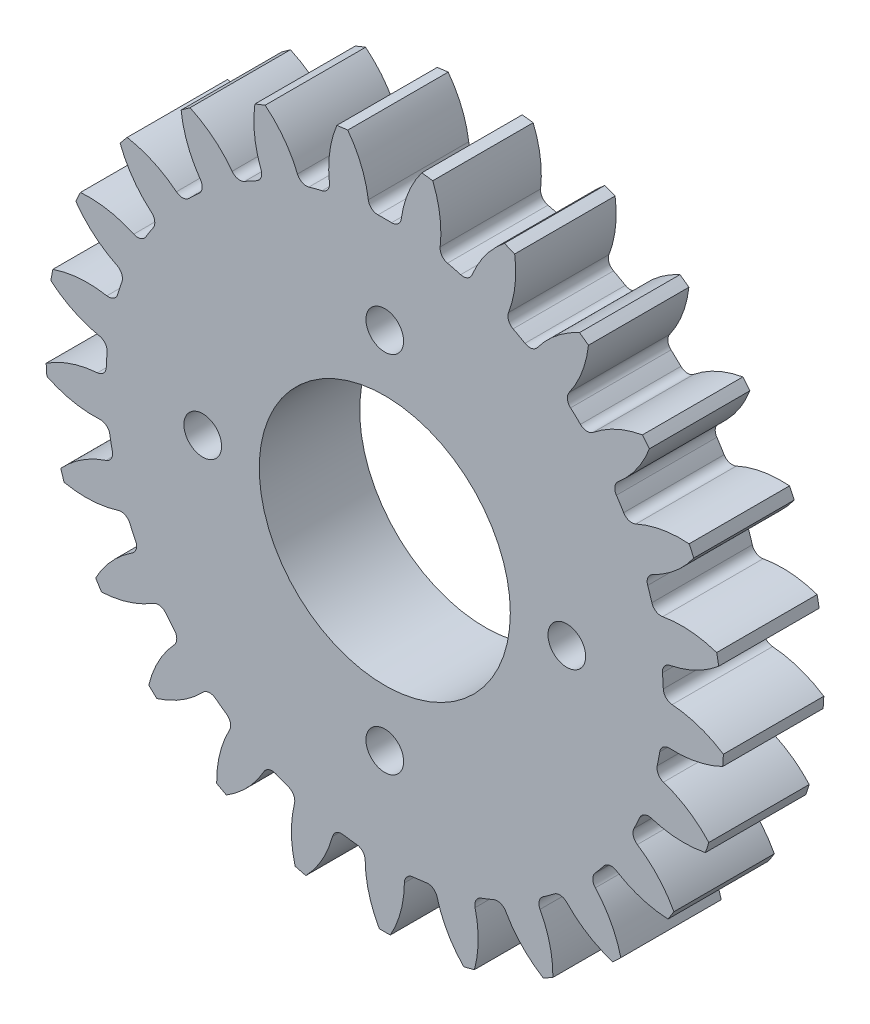
from build123d import *

# Parameters (mm, degrees)
SKETCH1_R                = 13.5
SKETCH1_R_2              = 5
SKETCH1_R_3              = 0.75
BOSS_EXTRUDE1_DEPTH      = 10
CUT_EXTRUDE3_START       = -10
CUT_EXTRUDE3_DEPTH       = 32.552262062
FILLET1_R                = 0.38
CIRPATTERN1_COUNT        = 25
FILLET1_OF_CIRPATTERN1_R = 0.38
CUT_EXTRUDE9_DEPTH       = 6
CUT_EXTRUDE9_DEPTH_BACK  = 22.543103055
SKETCH9_R                = 16.213384396


with BuildPart() as part:
    # Sketch1 → Boss-Extrude1 (new body)
    with BuildSketch(Plane.XY):
        Circle(SKETCH1_R)
        Circle(SKETCH1_R_2, mode=Mode.SUBTRACT)
        with Locations((-7.25, 0)):
            Circle(SKETCH1_R_3, mode=Mode.SUBTRACT)
        with Locations((0, 7.25)):
            Circle(SKETCH1_R_3, mode=Mode.SUBTRACT)
        with Locations((7.25, 0)):
            Circle(SKETCH1_R_3, mode=Mode.SUBTRACT)
        with Locations((0, -7.25)):
            Circle(SKETCH1_R_3, mode=Mode.SUBTRACT)
    extrude(amount=BOSS_EXTRUDE1_DEPTH)

    # Sketch2 → Cut-Extrude3 (cut)
    with BuildSketch(Plane.XY.offset(10).offset(CUT_EXTRUDE3_START)):
        with BuildLine():
            Line((44.349450934, 70.771523784), (1.473779826, 13.419313433))
            ThreePointArc((1.473779826, 13.419313433), (0.876171823, 12.313628186), (0.623245336, 11.082489127))
            ThreePointArc((0.623245336, 11.082489127), (0, 11.1), (-0.623245336, 11.082489127))
            ThreePointArc((-0.623245336, 11.082489127), (-0.876171823, 12.313628186), (-1.473779826, 13.419313433))
            Line((-1.473779826, 13.419313433), (-44.349450934, 70.771523784))
            Line((-44.349450934, 70.771523784), (-44.349450934, 213.986037085))
            Line((-44.349450934, 213.986037085), (44.349450934, 213.986037085))
            Line((44.349450934, 213.986037085), (44.349450934, 70.771523784))
        make_face()
    cut_extrude3 = extrude(amount=CUT_EXTRUDE3_DEPTH, mode=Mode.SUBTRACT)

    # Fillet1
    fillet1_edges = [part.edges().sort_by_distance(p)[0] for p in [
        (0.623245336, 11.082489127, 5),
        (-0.623245336, 11.082489127, 5),
    ]]
    fillet(fillet1_edges, radius=FILLET1_R)

    # CirPattern1: Cut-Extrude3 ×25 about axis
    cirpattern1_axis = Axis((0, 0, 0), (0, 0, 1))
    for i in range(1, CIRPATTERN1_COUNT):
        add(cut_extrude3.rotate(cirpattern1_axis, i * 360 / CIRPATTERN1_COUNT), mode=Mode.SUBTRACT)

    # Fillet1 of CirPattern1
    fillet1_of_cirpattern1_edges = [part.edges().sort_by_distance(p)[0] for p in [
        (-2.152438033, 10.889307164, 5),
        (-3.359767908, 10.57931754, 5),
        (-4.792875804, 10.011909984, 5),
        (-5.885183906, 9.411408523, 5),
        (-7.132159562, 8.505427678, 5),
        (-8.040812155, 7.652146097, 5),
        (-9.023303503, 6.464518071, 5),
        (-9.691206605, 5.412071188, 5),
        (-10.347480101, 4.017419018, 5),
        (-10.732666901, 2.831935943, 5),
        (-11.021486468, 1.317890753, 5),
        (-11.099754265, 0.073859747, 5),
        (-11.002972306, -1.464445434, 5),
        (-10.769403246, -2.688857329, 5),
        (-10.293100928, -4.154765129, 5),
        (-9.762371013, -5.282623609, 5),
        (-8.936476164, -6.584025651, 5),
        (-8.141933107, -7.54446322, 5),
        (-7.018339736, -8.599587627, 5),
        (-6.009907599, -9.332256461, 5),
        (-4.659215211, -10.074805885, 5),
        (-3.500257494, -10.533669706, 5),
        (-2.007335058, -10.916987037, 5),
        (-0.770673338, -11.073213743, 5),
        (0.770673338, -11.073213743, 5),
        (2.007335058, -10.916987037, 5),
        (3.500257494, -10.533669706, 5),
        (4.659215211, -10.074805885, 5),
        (6.009907599, -9.332256461, 5),
        (7.018339736, -8.599587627, 5),
        (8.141933107, -7.54446322, 5),
        (8.936476164, -6.584025651, 5),
        (9.762371013, -5.282623609, 5),
        (10.293100928, -4.154765129, 5),
        (10.769403246, -2.688857329, 5),
        (11.002972306, -1.464445434, 5),
        (11.099754265, 0.073859747, 5),
        (11.021486468, 1.317890753, 5),
        (10.732666901, 2.831935943, 5),
        (10.347480101, 4.017419018, 5),
        (9.691206605, 5.412071188, 5),
        (9.023303503, 6.464518071, 5),
        (8.040812155, 7.652146097, 5),
        (7.132159562, 8.505427678, 5),
        (5.885183906, 9.411408523, 5),
        (4.792875804, 10.011909984, 5),
        (3.359767908, 10.57931754, 5),
        (2.152438033, 10.889307164, 5),
    ]]
    fillet(fillet1_of_cirpattern1_edges, radius=FILLET1_OF_CIRPATTERN1_R)

    # Sketch9 → Cut-Extrude9 (cut, two sides: drawn at the far end of the back side and taken through both)
    with BuildSketch(Plane.XY.offset(-CUT_EXTRUDE9_DEPTH_BACK)):
        Circle(SKETCH9_R)
    extrude(amount=CUT_EXTRUDE9_DEPTH + CUT_EXTRUDE9_DEPTH_BACK, mode=Mode.SUBTRACT)


solid = part.part
